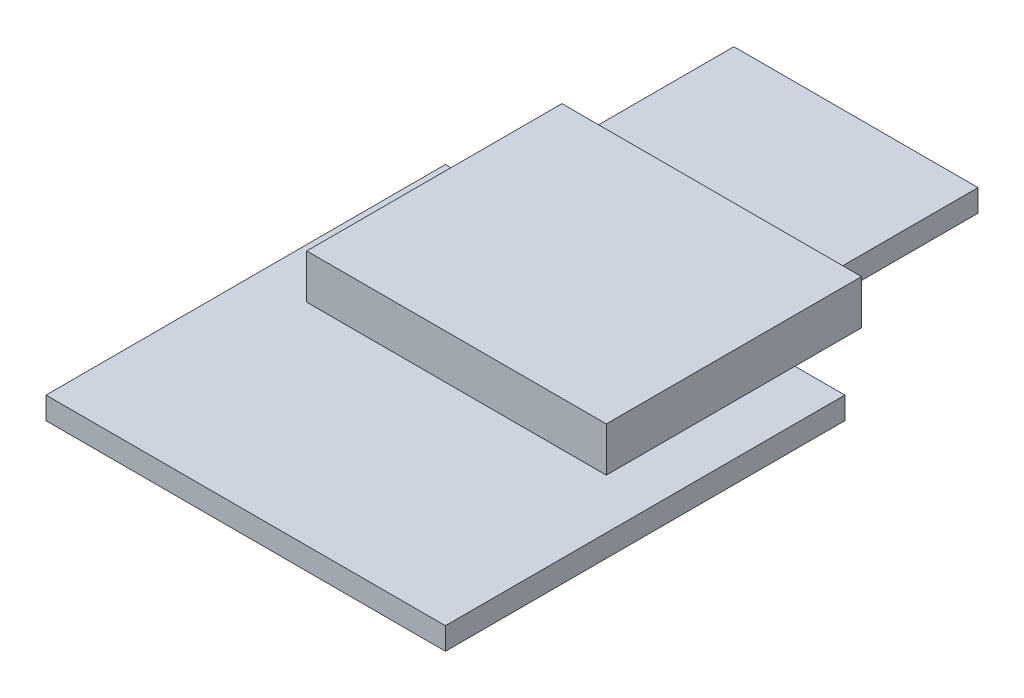
from build123d import *

# Parameters (mm, degrees)
SKETCH1_W           = 18
SKETCH1_H           = 18
BOSS_EXTRUDE1_DEPTH = 1
SKETCH2_W           = 13.5
SKETCH2_H           = 11.5
BOSS_EXTRUDE2_DEPTH = 2
SKETCH3_W           = 11
SKETCH3_H           = 1
BOSS_EXTRUDE3_DEPTH = 6.5


with BuildPart() as part:
    # Sketch1 → Boss-Extrude1 (new body)
    with BuildSketch(Plane(origin=(0, 0, 0), x_dir=(1, 0, 0), z_dir=(0, 1, 0))):
        with Locations((9, -9)):
            Rectangle(SKETCH1_W, SKETCH1_H)
    extrude(amount=BOSS_EXTRUDE1_DEPTH)

    # Sketch2 → Boss-Extrude2 (add)
    with BuildSketch(Plane(origin=(0, 1, 0), x_dir=(1, 0, 0), z_dir=(0, 1, 0))):
        with Locations((9, -2.75)):
            Rectangle(SKETCH2_W, SKETCH2_H)
    extrude(amount=BOSS_EXTRUDE2_DEPTH)

    # Sketch3 → Boss-Extrude3 (add)
    with BuildSketch(Plane(origin=(0, 0, -3), x_dir=(-1, 0, 0), z_dir=(0, 0, -1))):
        with Locations((-9, 2.09682187)):
            Rectangle(SKETCH3_W, SKETCH3_H)
    extrude(amount=BOSS_EXTRUDE3_DEPTH)


solid = part.part
